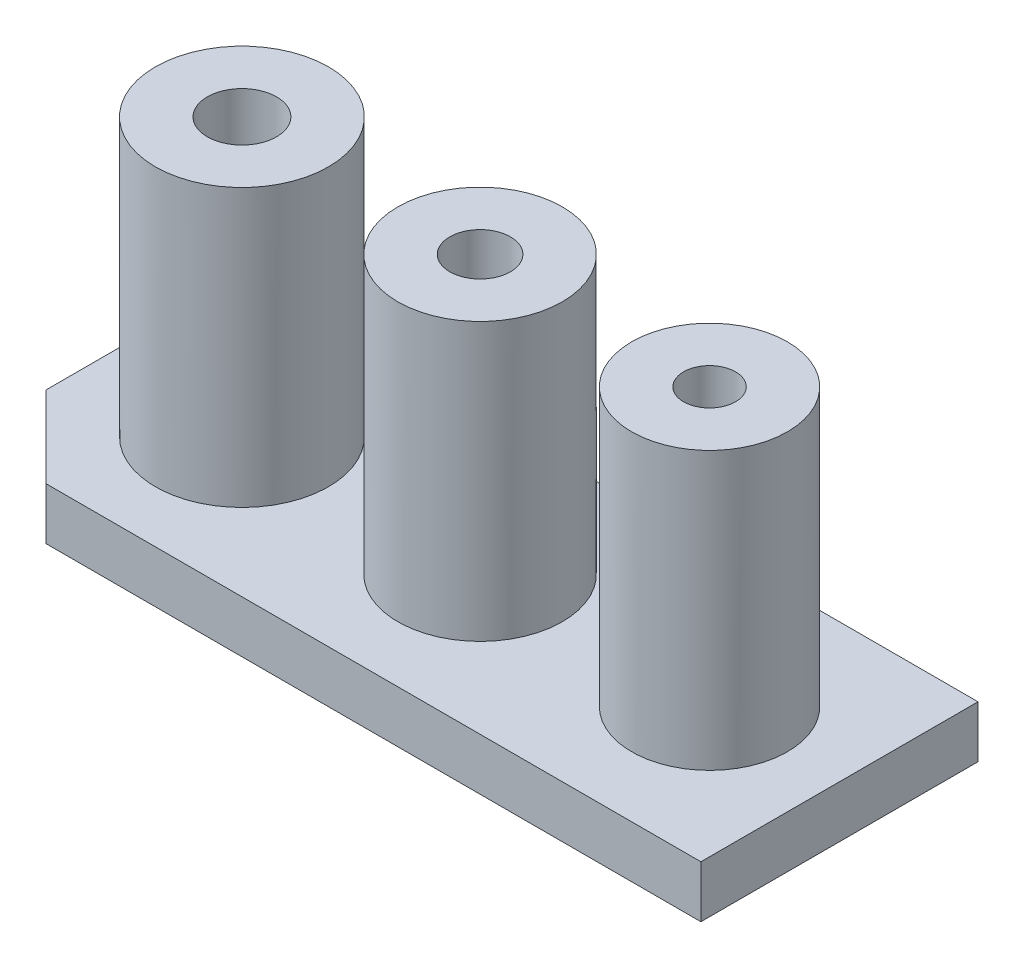
from build123d import *

# Parameters (mm, degrees)
SKETCH1_R             = 2.5
SKETCH1_R_2           = 1
BOSS_EXTRUDE1_DEPTH   = 8
SKETCH1_R_3           = 2.375
SKETCH1_R_4           = 0.875
BOSS_EXTRUDE1_2_DEPTH = 8
SKETCH1_R_5           = 2.25
SKETCH1_R_6           = 0.75
BOSS_EXTRUDE1_3_DEPTH = 8
BOSS_EXTRUDE2_START   = 1.5
SKETCH2_R             = 2.5
SKETCH2_R_2           = 1
BOSS_EXTRUDE2_DEPTH   = 1.5


with BuildPart() as part:
    # Sketch1 → Boss-Extrude1 (new body)
    with BuildSketch(Plane(origin=(0, 0, 0), x_dir=(1, 0, 0), z_dir=(0, 1, 0))):
        with Locations(Location((0, 0, 0), (0, 0, 270))):
            Circle(SKETCH1_R)
        with Locations(Location((0, 0, 0), (0, 0, 270))):
            Circle(SKETCH1_R_2, mode=Mode.SUBTRACT)
    extrude(amount=BOSS_EXTRUDE1_DEPTH)



with BuildPart() as body_2:
    # Sketch1 → Boss-Extrude1 2 (new body)
    with BuildSketch(Plane(origin=(0, 0, 0), x_dir=(1, 0, 0), z_dir=(0, 1, 0))):
        with Locations(Location((6.875, 0, 0), (0, 0, 270))):
            Circle(SKETCH1_R_3)
        with Locations(Location((6.875, 0, 0), (0, 0, 270))):
            Circle(SKETCH1_R_4, mode=Mode.SUBTRACT)
    extrude(amount=BOSS_EXTRUDE1_2_DEPTH)


with BuildPart() as body_3:
    # Sketch1 → Boss-Extrude1 3 (new body)
    with BuildSketch(Plane(origin=(0, 0, 0), x_dir=(1, 0, 0), z_dir=(0, 1, 0))):
        with Locations(Location((13.5, 0, 0), (0, 0, 270))):
            Circle(SKETCH1_R_5)
        with Locations(Location((13.5, 0, 0), (0, 0, 270))):
            Circle(SKETCH1_R_6, mode=Mode.SUBTRACT)
    extrude(amount=BOSS_EXTRUDE1_3_DEPTH)


with BuildPart() as part_1:
    add(part.part)

    add(body_2.part)  # Boss-Extrude2 merges body 2

    add(body_3.part)  # Boss-Extrude2 merges body 3
    # Sketch2 → Boss-Extrude2 (add)
    # profile 1 of 3: a face of its own
    with BuildSketch(Plane.XZ.offset(BOSS_EXTRUDE2_START)):
        Polygon((17.25, 4), (-1.656854249, 4), (-4, 1.656854249), (-4, -4), (17.25, -4), align=None)
        with Locations(Location((0, 0, 0), (0, 0, 270))):
            Circle(SKETCH2_R, mode=Mode.SUBTRACT)
    # profile 2 of 3: a face of its own
    with BuildSketch(Plane.XZ.offset(BOSS_EXTRUDE2_START)):
        with Locations(Location((0, 0, 0), (0, 0, 270))):
            Circle(SKETCH2_R)
        with Locations(Location((0, 0, 0), (0, 0, 90))):
            Circle(SKETCH2_R_2, mode=Mode.SUBTRACT)
    # profile 3 of 3: a face of its own
    with BuildSketch(Plane.XZ.offset(BOSS_EXTRUDE2_START)):
        with Locations(Location((0, 0, 0), (0, 0, 90))):
            Circle(SKETCH2_R_2)
    extrude(amount=-BOSS_EXTRUDE2_DEPTH)


solid = part_1.part
